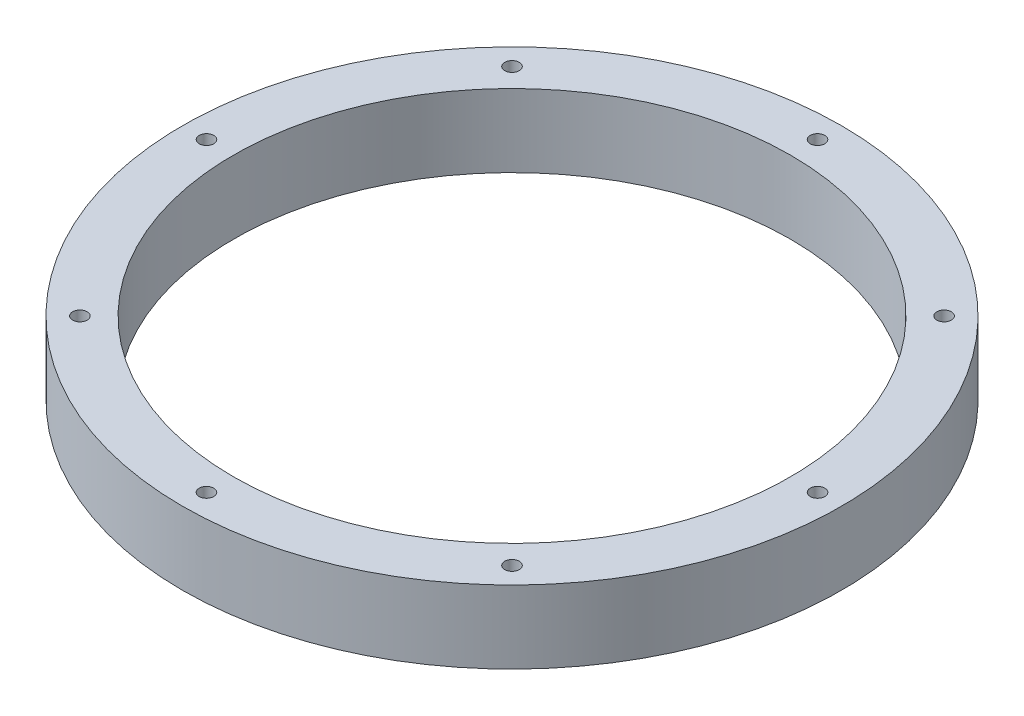
from build123d import *

# Parameters (mm, degrees)
SKETCH_1_W          = 14
SKETCH_1_H          = 20
SKETCH_2_R          = 2
CUT_EXTRUDE_1_DEPTH = 130.539569244


with BuildPart() as part:
    # 草图1 → 旋转1 (revolve)
    with BuildSketch(Plane.XY, mode=Mode.PRIVATE) as revolve_1_sk:
        with Locations((83.5, 10)):
            Rectangle(SKETCH_1_W, SKETCH_1_H)
    revolve(revolve_1_sk.sketch.rotate(Axis((0, 0, 0), (0, 1, 0)), 90), axis=Axis((0, 0, 0), (0, 1, 0)))

    # 草图2 → 切除-拉伸1 (cut, through all)
    with BuildSketch(Plane(origin=(0, 20, 0), x_dir=(1, 0, 0), z_dir=(0, 1, 0))):
        with Locations(Location((-83.9, 0, 0), (0, 0, 270))):
            Circle(SKETCH_2_R)
        with Locations(Location((-59.326258942, 59.326258942, 0), (0, 0, 270))):
            Circle(SKETCH_2_R)
        with Locations(Location((0, 83.9, 0), (0, 0, 270))):
            Circle(SKETCH_2_R)
        with Locations(Location((59.326258942, 59.326258942, 0), (0, 0, 270))):
            Circle(SKETCH_2_R)
        with Locations(Location((83.9, 0, 0), (0, 0, 270))):
            Circle(SKETCH_2_R)
        with Locations(Location((59.326258942, -59.326258942, 0), (0, 0, 270))):
            Circle(SKETCH_2_R)
        with Locations(Location((0, -83.9, 0), (0, 0, 270))):
            Circle(SKETCH_2_R)
        with Locations(Location((-59.326258942, -59.326258942, 0), (0, 0, 270))):
            Circle(SKETCH_2_R)
    extrude(amount=-CUT_EXTRUDE_1_DEPTH, mode=Mode.SUBTRACT)


solid = part.part
